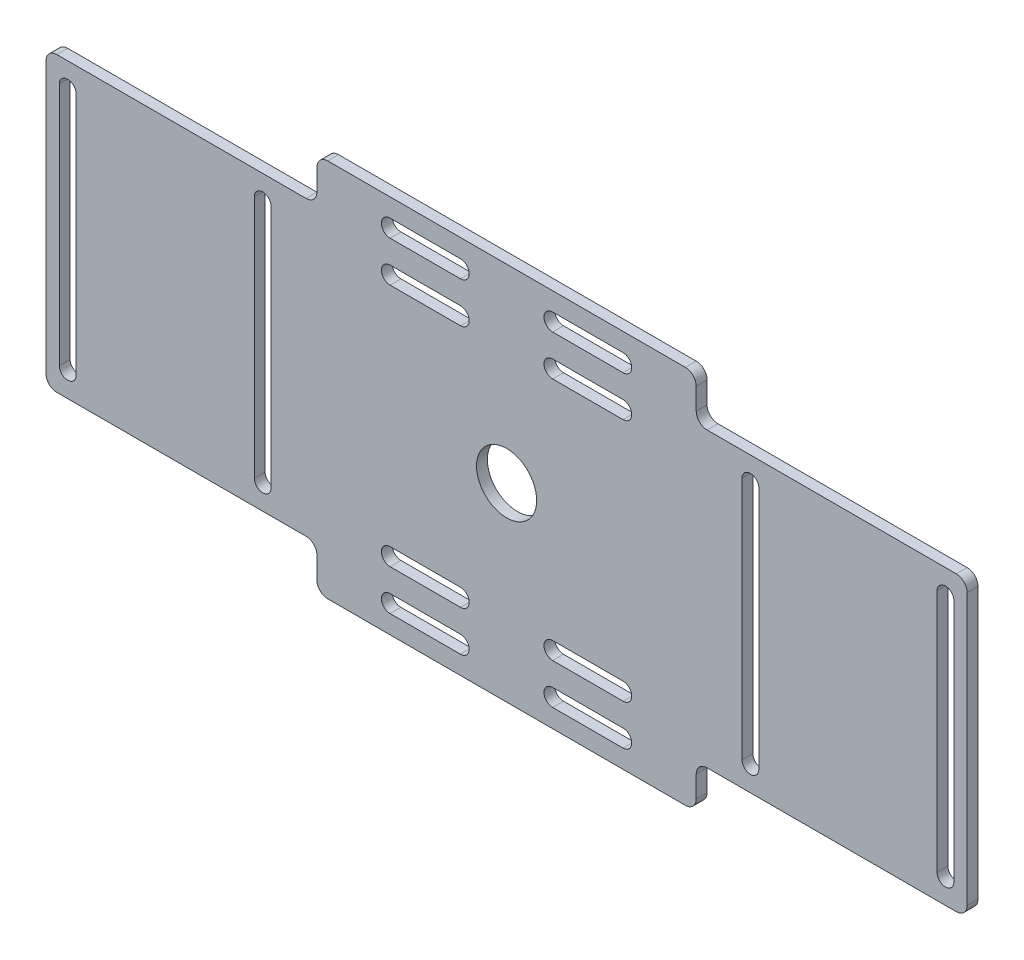
from build123d import *

# Parameters (mm, degrees)
SKETCH_1_W          = 170
SKETCH_1_H          = 70
EXTRUDE_1_DEPTH     = 2
SKETCH_2_R          = 5.55
CUT_EXTRUDE_1_DEPTH = 92.945636112
CUT_EXTRUDE_2_DEPTH = 92.945636112


with BuildPart() as part:
    # 草圖1 → 填料-伸長1 (new body)
    with BuildSketch(Plane.XY):
        Rectangle(SKETCH_1_W, SKETCH_1_H)
    extrude(amount=EXTRUDE_1_DEPTH)

    # 草圖2 → 除料-伸長1 (cut, through all)
    with BuildSketch(Plane.XY.offset(2)):
        Circle(SKETCH_2_R)
        with BuildLine():
            Line((43.45, -22.5), (43.45, 22.5))
            ThreePointArc((43.45, 22.5), (45, 24.05), (46.55, 22.5))
            Line((46.55, 22.5), (46.55, -22.5))
            ThreePointArc((46.55, -22.5), (45, -24.05), (43.45, -22.5))
        make_face()
        with BuildLine():
            Line((-46.55, -22.5), (-46.55, 22.5))
            ThreePointArc((-46.55, 22.5), (-45, 24.05), (-43.45, 22.5))
            Line((-43.45, 22.5), (-43.45, -22.5))
            ThreePointArc((-43.45, -22.5), (-45, -24.05), (-46.55, -22.5))
        make_face()
        with BuildLine():
            Line((21.5, 28.4), (8.5, 28.4))
            ThreePointArc((8.5, 28.4), (6.9, 30), (8.5, 31.6))
            Line((8.5, 31.6), (21.5, 31.6))
            ThreePointArc((21.5, 31.6), (23.1, 30), (21.5, 28.4))
        make_face()
        with BuildLine():
            Line((-82.55, -22.5), (-82.55, 22.5))
            ThreePointArc((-82.55, 22.5), (-81, 24.05), (-79.45, 22.5))
            Line((-79.45, 22.5), (-79.45, -22.5))
            ThreePointArc((-79.45, -22.5), (-81, -24.05), (-82.55, -22.5))
        make_face()
        with BuildLine():
            Line((79.45, -22.5), (79.45, 22.5))
            ThreePointArc((79.45, 22.5), (81, 24.05), (82.55, 22.5))
            Line((82.55, 22.5), (82.55, -22.5))
            ThreePointArc((82.55, -22.5), (81, -24.05), (79.45, -22.5))
        make_face()
        with BuildLine():
            Line((21.5, 20.9), (8.5, 20.9))
            ThreePointArc((8.5, 20.9), (6.9, 22.5), (8.5, 24.1))
            Line((8.5, 24.1), (21.5, 24.1))
            ThreePointArc((21.5, 24.1), (23.1, 22.5), (21.5, 20.9))
        make_face()
        with BuildLine():
            Line((-21.5, 28.4), (-8.5, 28.4))
            ThreePointArc((-8.5, 28.4), (-6.9, 30), (-8.5, 31.6))
            Line((-8.5, 31.6), (-21.5, 31.6))
            ThreePointArc((-21.5, 31.6), (-23.1, 30), (-21.5, 28.4))
        make_face()
        with BuildLine():
            Line((-21.5, 20.9), (-8.5, 20.9))
            ThreePointArc((-8.5, 20.9), (-6.9, 22.5), (-8.5, 24.1))
            Line((-8.5, 24.1), (-21.5, 24.1))
            ThreePointArc((-21.5, 24.1), (-23.1, 22.5), (-21.5, 20.9))
        make_face()
        with BuildLine():
            Line((21.5, -28.4), (8.5, -28.4))
            ThreePointArc((8.5, -28.4), (6.9, -30), (8.5, -31.6))
            Line((8.5, -31.6), (21.5, -31.6))
            ThreePointArc((21.5, -31.6), (23.1, -30), (21.5, -28.4))
        make_face()
        with BuildLine():
            Line((21.5, -20.9), (8.5, -20.9))
            ThreePointArc((8.5, -20.9), (6.9, -22.5), (8.5, -24.1))
            Line((8.5, -24.1), (21.5, -24.1))
            ThreePointArc((21.5, -24.1), (23.1, -22.5), (21.5, -20.9))
        make_face()
        with BuildLine():
            Line((-21.5, -28.4), (-8.5, -28.4))
            ThreePointArc((-8.5, -28.4), (-6.9, -30), (-8.5, -31.6))
            Line((-8.5, -31.6), (-21.5, -31.6))
            ThreePointArc((-21.5, -31.6), (-23.1, -30), (-21.5, -28.4))
        make_face()
        with BuildLine():
            Line((-21.5, -20.9), (-8.5, -20.9))
            ThreePointArc((-8.5, -20.9), (-6.9, -22.5), (-8.5, -24.1))
            Line((-8.5, -24.1), (-21.5, -24.1))
            ThreePointArc((-21.5, -24.1), (-23.1, -22.5), (-21.5, -20.9))
        make_face()
    extrude(amount=-CUT_EXTRUDE_1_DEPTH, mode=Mode.SUBTRACT)

    # 草圖4 → 除料-伸長2 (cut, through all)
    with BuildSketch(Plane.XY.offset(2)):
        with BuildLine():
            Line((85, 35), (33, 35))
            ThreePointArc((33, 35), (34.414213562, 34.414213562), (35, 33))
            Line((35, 33), (35, 29))
            ThreePointArc((35, 29), (35.585786438, 27.585786438), (37, 27))
            Line((37, 27), (83, 27))
            ThreePointArc((83, 27), (84.414213562, 26.414213562), (85, 25))
            Line((85, 25), (85, 35))
        make_face()
        with BuildLine():
            Line((35, -33), (35, -29))
            ThreePointArc((35, -29), (35.585786438, -27.585786438), (37, -27))
            Line((37, -27), (83, -27))
            ThreePointArc((83, -27), (84.414213562, -26.414213562), (85, -25))
            Line((85, -25), (85, -35))
            Line((85, -35), (33, -35))
            ThreePointArc((33, -35), (34.414213562, -34.414213562), (35, -33))
        make_face()
        with BuildLine():
            Line((-85, -35), (-33, -35))
            ThreePointArc((-33, -35), (-34.414213562, -34.414213562), (-35, -33))
            Line((-35, -33), (-35, -29))
            ThreePointArc((-35, -29), (-35.585786438, -27.585786438), (-37, -27))
            Line((-37, -27), (-83, -27))
            ThreePointArc((-83, -27), (-84.414213562, -26.414213562), (-85, -25))
            Line((-85, -25), (-85, -35))
        make_face()
        with BuildLine():
            Line((-35, 33), (-35, 29))
            ThreePointArc((-35, 29), (-35.585786438, 27.585786438), (-37, 27))
            Line((-37, 27), (-83, 27))
            ThreePointArc((-83, 27), (-84.414213562, 26.414213562), (-85, 25))
            Line((-85, 25), (-85, 35))
            Line((-85, 35), (-33, 35))
            ThreePointArc((-33, 35), (-34.414213562, 34.414213562), (-35, 33))
        make_face()
    extrude(amount=-CUT_EXTRUDE_2_DEPTH, mode=Mode.SUBTRACT)


solid = part.part
